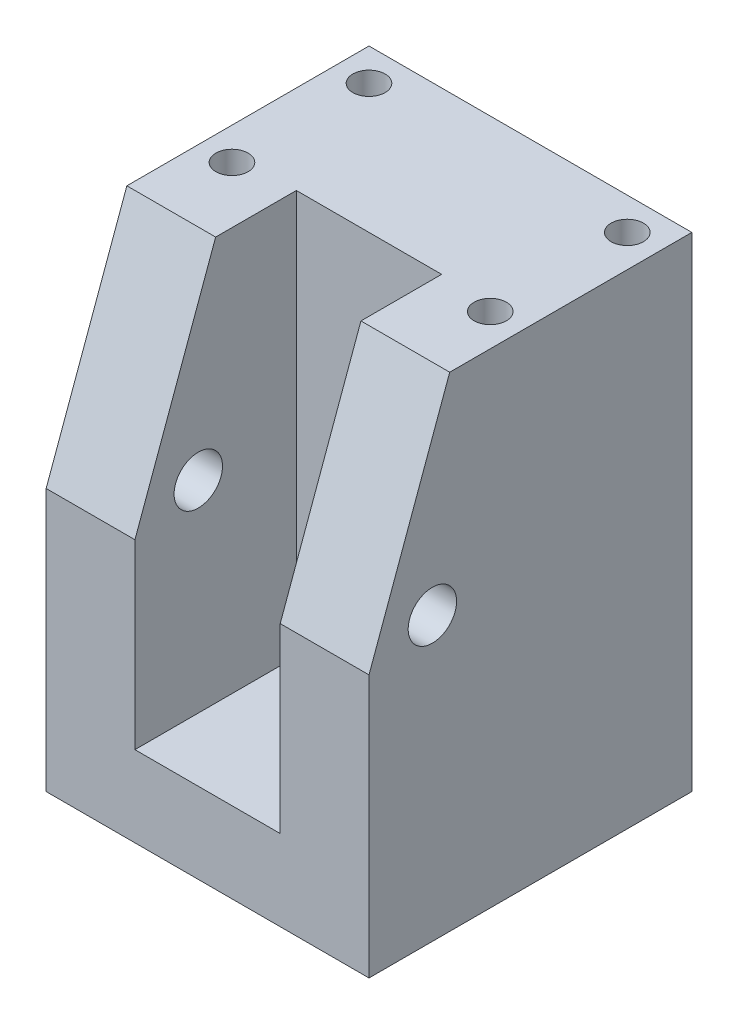
from build123d import *

# Parameters (mm, degrees)
SKETCH1_W               = 40
SKETCH1_H               = 40
BOSS_EXTRUDE1_DEPTH     = 60
SKETCH1_3_W             = 18
SKETCH1_3_H             = 20
CUT_EXTRUDE1_DEPTH      = 50
CUT_EXTRUDE3_DEPTH      = 28
CUT_EXTRUDE3_DEPTH_BACK = 70
SKETCH4_R               = 2
CUT_EXTRUDE4_DEPTH      = 57
CUT_EXTRUDE4_DEPTH_BACK = 57
SKETCH5_R               = 3
CHAMFER1_SIZE           = 10
CHAMFER1_SIZE2          = 27.474774195


with BuildPart() as part:
    # Sketch1 → Boss-Extrude1 (new body)
    with BuildSketch(Plane(origin=(0, 0, 0), x_dir=(1, 0, 0), z_dir=(0, 1, 0))):
        Rectangle(SKETCH1_W, SKETCH1_H)
    extrude(amount=-BOSS_EXTRUDE1_DEPTH)

    # Sketch1<3> → Cut-Extrude1 (cut)
    with BuildSketch(Plane(origin=(0, 0, 0), x_dir=(1, 0, 0), z_dir=(0, 1, 0))):
        with Locations((0, -10)):
            Rectangle(SKETCH1_3_W, SKETCH1_3_H)
    extrude(amount=-CUT_EXTRUDE1_DEPTH, mode=Mode.SUBTRACT)

    # Sketch4 → Cut-Extrude3 (cut, two sides: drawn at the far end of the back side and taken through both)
    with BuildSketch(Plane(origin=(0, 0, 0), x_dir=(1, 0, 0), z_dir=(0, 1, 0)).offset(-CUT_EXTRUDE3_DEPTH_BACK)):
        with Locations((-16, 16)):
            Circle(SKETCH4_R)
        with Locations((16, 16)):
            Circle(SKETCH4_R)
        with Locations((16, -0.977001598)):
            Circle(SKETCH4_R)
        with Locations((-16, -0.977001598)):
            Circle(SKETCH4_R)
    extrude(amount=CUT_EXTRUDE3_DEPTH + CUT_EXTRUDE3_DEPTH_BACK, mode=Mode.SUBTRACT)

    # Sketch5 → Cut-Extrude4 (cut, two sides: drawn at the far end of the back side and taken through both)
    with BuildSketch(Plane.ZY.offset(-9).offset(-CUT_EXTRUDE4_DEPTH_BACK)):
        with Locations((12.148726145, -25)):
            Circle(SKETCH5_R)
    extrude(amount=CUT_EXTRUDE4_DEPTH + CUT_EXTRUDE4_DEPTH_BACK, mode=Mode.SUBTRACT)

    # Chamfer1
    chamfer1_edges = [part.edges().sort_by_distance(p)[0] for p in [
        (14.5, 0, 20),
        (-14.5, 0, 20),
    ]]
    chamfer1_side = [part.faces().sort_by_distance(p)[0] for p in [
        (0, 0, -2.708529358),
    ]]
    chamfer(chamfer1_edges, length=CHAMFER1_SIZE, length2=CHAMFER1_SIZE2, reference=chamfer1_side[0])


solid = part.part
